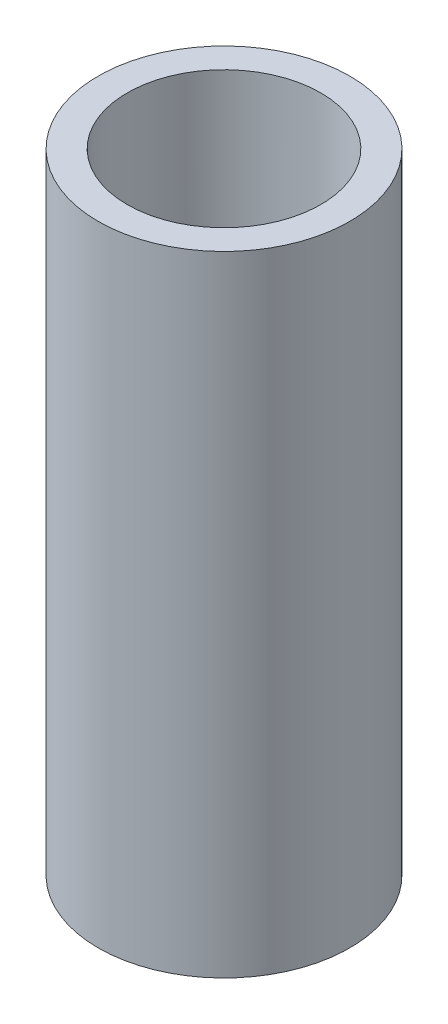
from build123d import *

# Parameters (mm, degrees)
BUITENCIRKEL_R                    = 13
CILINDER_BASIS_DEPTH              = 65
BINNENCIRKEL_MOTOR_R              = 11
HOLTE_MOTOR_DEPTH                 = 25
BINNENCIRKEL_BUIS_R               = 10
HOLTE_BUIS_DEPTH                  = 35
UITSPARING_MOTORAS_DEPTH          = 45.022721406
CIRKEL_MOTORPINNETJES_R           = 0.9
UITSPARINGEN_MOTORPINNETJES_DEPTH = 2
CIRKEL_POLEN_R                    = 2.45
UITSPARINGEN_MOTORPOLEN_DEPTH     = 45.022721406


with BuildPart() as part:
    # Buitencirkel → Cilinder basis (new body)
    with BuildSketch(Plane(origin=(0, 0, 0), x_dir=(1, 0, 0), z_dir=(0, 1, 0))):
        with Locations(Location((0, 0, 0), (0, 0, 270))):
            Circle(BUITENCIRKEL_R)
    extrude(amount=CILINDER_BASIS_DEPTH)

    # Binnencirkel motor → Holte motor (cut)
    with BuildSketch(Plane(origin=(0, 0, 0), x_dir=(-1, 0, 0), z_dir=(0, -1, 0))):
        with Locations(Location((0, 0, 0), (0, 0, 90))):
            Circle(BINNENCIRKEL_MOTOR_R)
    extrude(amount=-HOLTE_MOTOR_DEPTH, mode=Mode.SUBTRACT)

    # Binnencirkel buis → Holte buis (cut)
    with BuildSketch(Plane(origin=(0, 65, 0), x_dir=(1, 0, 0), z_dir=(0, 1, 0))):
        with Locations(Location((0, 0, 0), (0, 0, 270))):
            Circle(BINNENCIRKEL_BUIS_R)
    extrude(amount=-HOLTE_BUIS_DEPTH, mode=Mode.SUBTRACT)

    # Cirkel motoras → Uitsparing motoras (cut, through all)
    with BuildSketch(Plane(origin=(0, 25, 0), x_dir=(-1, 0, 0), z_dir=(0, -1, 0))):
        with BuildLine():
            Line((2.35, -1.61245155), (2.35, 1.61245155))
            ThreePointArc((2.35, 1.61245155), (-2.85, 0), (2.35, -1.61245155))
        make_face()
    extrude(amount=-UITSPARING_MOTORAS_DEPTH, mode=Mode.SUBTRACT)

    # Cirkel motorpinnetjes → Uitsparingen motorpinnetjes (add)
    with BuildSketch(Plane(origin=(0, 25, 0), x_dir=(-1, 0, 0), z_dir=(0, -1, 0))):
        with Locations(Location((-5.5, 0, 0), (0, 0, 90))):
            Circle(CIRKEL_MOTORPINNETJES_R)
        with Locations(Location((5.5, 0, 0), (0, 0, 270))):
            Circle(CIRKEL_MOTORPINNETJES_R)
    extrude(amount=UITSPARINGEN_MOTORPINNETJES_DEPTH)

    # Cirkel polen → Uitsparingen motorpolen (cut, through all)
    with BuildSketch(Plane(origin=(0, 25, 0), x_dir=(-1, 0, 0), z_dir=(0, -1, 0))):
        with Locations(Location((0, -7.55, 0), (0, 0, 90))):
            Circle(CIRKEL_POLEN_R)
        with Locations(Location((0, 7.55, 0), (0, 0, 89.999404226))):
            Circle(CIRKEL_POLEN_R)
    extrude(amount=-UITSPARINGEN_MOTORPOLEN_DEPTH, mode=Mode.SUBTRACT)


solid = part.part
